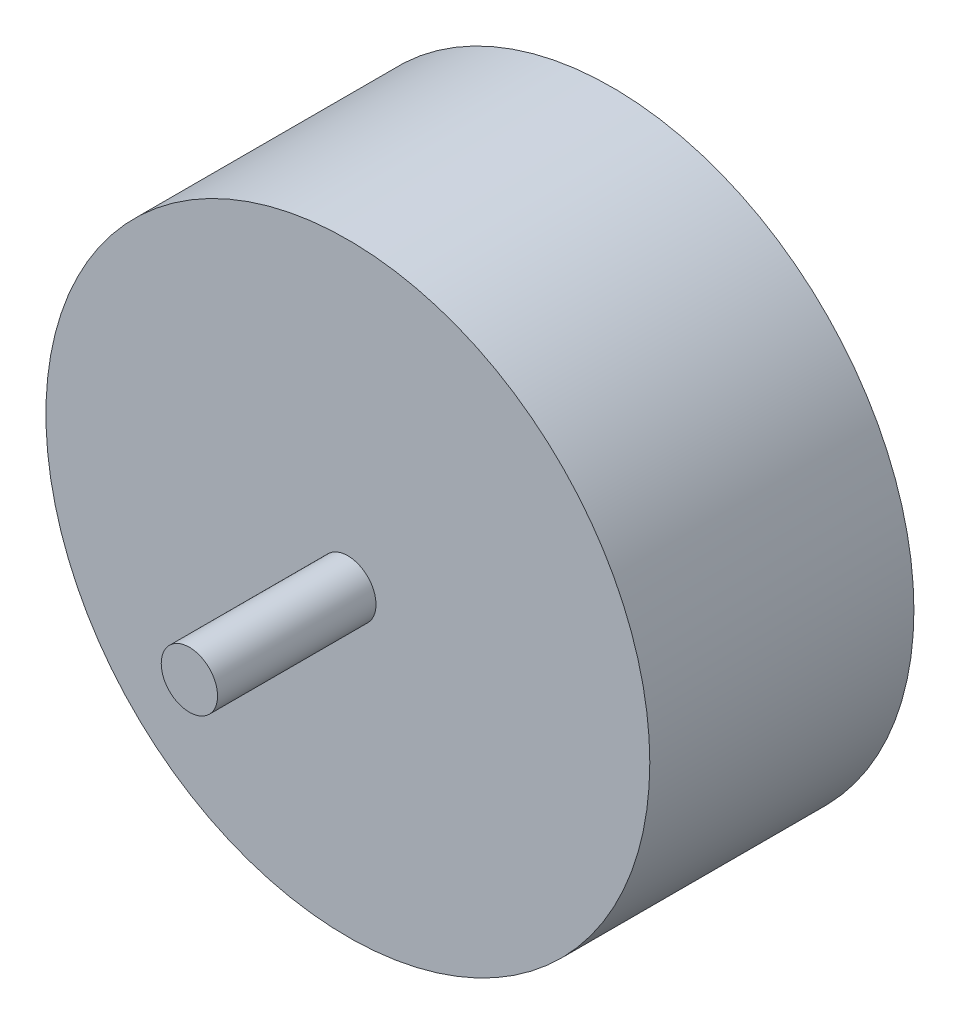
from build123d import *

# Parameters (mm, degrees)
SKETCH1_R           = 85.75
BOSS_EXTRUDE1_DEPTH = 75
SKETCH2_R           = 8
BOSS_EXTRUDE2_DEPTH = 45


with BuildPart() as part:
    # Sketch1 → Boss-Extrude1 (new body)
    with BuildSketch(Plane.XY):
        Circle(SKETCH1_R)
    extrude(amount=BOSS_EXTRUDE1_DEPTH)

    # Sketch2 → Boss-Extrude2 (add)
    with BuildSketch(Plane.XY.offset(75)):
        with Locations(Location((0, 0, 0), (0, 0, 180))):
            Circle(SKETCH2_R)
    extrude(amount=BOSS_EXTRUDE2_DEPTH)


solid = part.part
